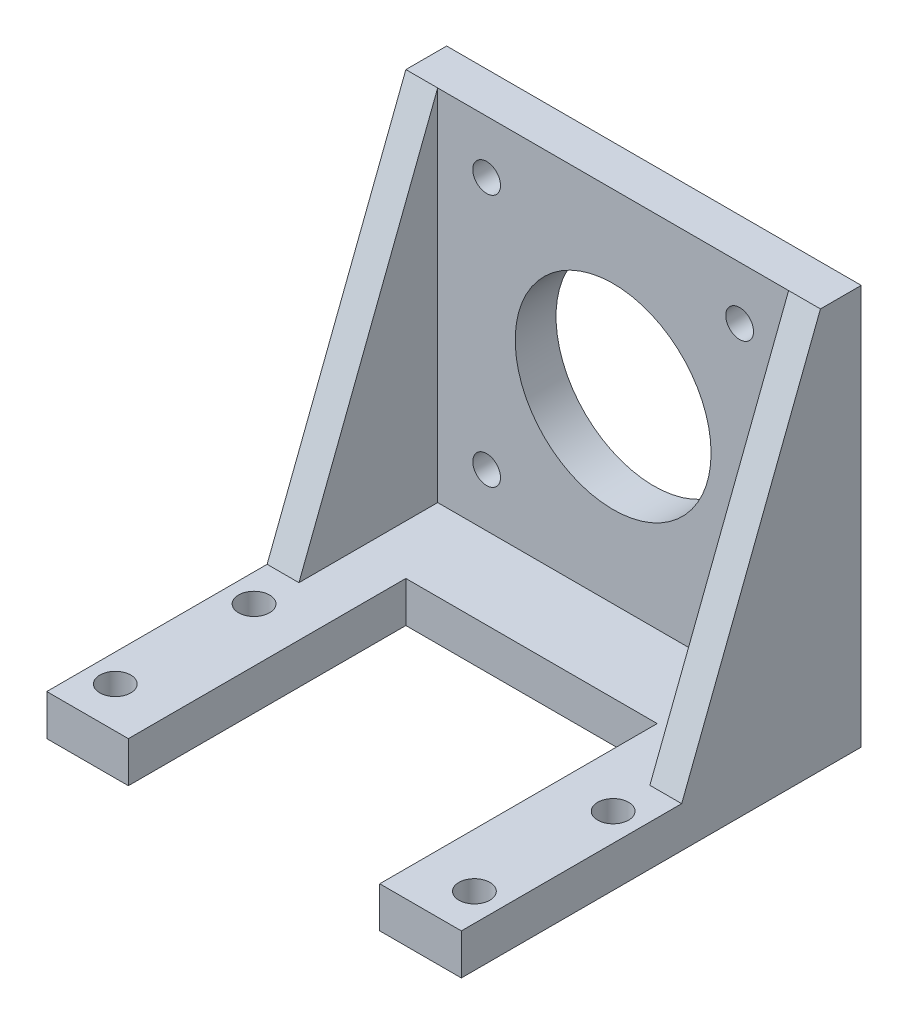
from build123d import *

# Parameters (mm, degrees)
BOSS_EXTRUDE1_DEPTH = 25.4
SKETCH2_R           = 1.7
SKETCH2_R_2         = 12
CUT_EXTRUDE1_DEPTH  = 58.533989954
SKETCH4_W           = 30.8
SKETCH4_H           = 34
CUT_EXTRUDE2_DEPTH  = 58.533989954
SKETCH5_R           = 1.89865
CUT_EXTRUDE3_DEPTH  = 58.533989954
BOSS_EXTRUDE2_DEPTH = 3.9


with BuildPart() as part:
    # Sketch1 → Boss-Extrude1 (new, symmetric)
    with BuildSketch(Plane(origin=(0, 0, 0), x_dir=(0, 0, -1), z_dir=(1, 0, 0))):
        Polygon((-22, -22), (-22, -27), (27, -27), (27, 22), (22, 22), (22, -22), align=None)
    extrude(amount=BOSS_EXTRUDE1_DEPTH, both=True)

    # Sketch2 → Cut-Extrude1 (cut, through all)
    with BuildSketch(Plane.XY.offset(-22)):
        with Locations((-15.5, 15.5)):
            Circle(SKETCH2_R)
        with Locations((15.5, 15.5)):
            Circle(SKETCH2_R)
        with Locations((15.5, -15.5)):
            Circle(SKETCH2_R)
        with Locations((-15.5, -15.5)):
            Circle(SKETCH2_R)
        Circle(SKETCH2_R_2)
    extrude(amount=-CUT_EXTRUDE1_DEPTH, mode=Mode.SUBTRACT)

    # Sketch4 → Cut-Extrude2 (cut, through all)
    with BuildSketch(Plane(origin=(0, -22, 0), x_dir=(1, 0, 0), z_dir=(0, 1, 0))):
        with Locations((0, -5)):
            Rectangle(SKETCH4_W, SKETCH4_H)
    extrude(amount=-CUT_EXTRUDE2_DEPTH, mode=Mode.SUBTRACT)

    # Sketch5 → Cut-Extrude3 (cut, through all)
    with BuildSketch(Plane(origin=(0, -22, 0), x_dir=(1, 0, 0), z_dir=(0, 1, 0))):
        with Locations(Location((-22, 0, 0), (0, 0, 270))):
            Circle(SKETCH5_R)
        with Locations(Location((22, 0, 0), (0, 0, 270))):
            Circle(SKETCH5_R)
        with Locations(Location((22, -17, 0), (0, 0, 270))):
            Circle(SKETCH5_R)
        with Locations(Location((-22, -17, 0), (0, 0, 270))):
            Circle(SKETCH5_R)
    extrude(amount=-CUT_EXTRUDE3_DEPTH, mode=Mode.SUBTRACT)

    # Sketch6 → Boss-Extrude2 (add)
    with BuildSketch(Plane(origin=(25.4, 0, 0), x_dir=(0, 0, -1), z_dir=(1, 0, 0))):
        Polygon((22, 22), (5, -22), (22, -22), align=None)
    boss_extrude2 = extrude(amount=-BOSS_EXTRUDE2_DEPTH)

    # Mirror1: Boss-Extrude2 across plane
    add(boss_extrude2.mirror(Plane(origin=(0, 0, 0), x_dir=(0, 0, 1), z_dir=(1, 0, 0))))


solid = part.part
